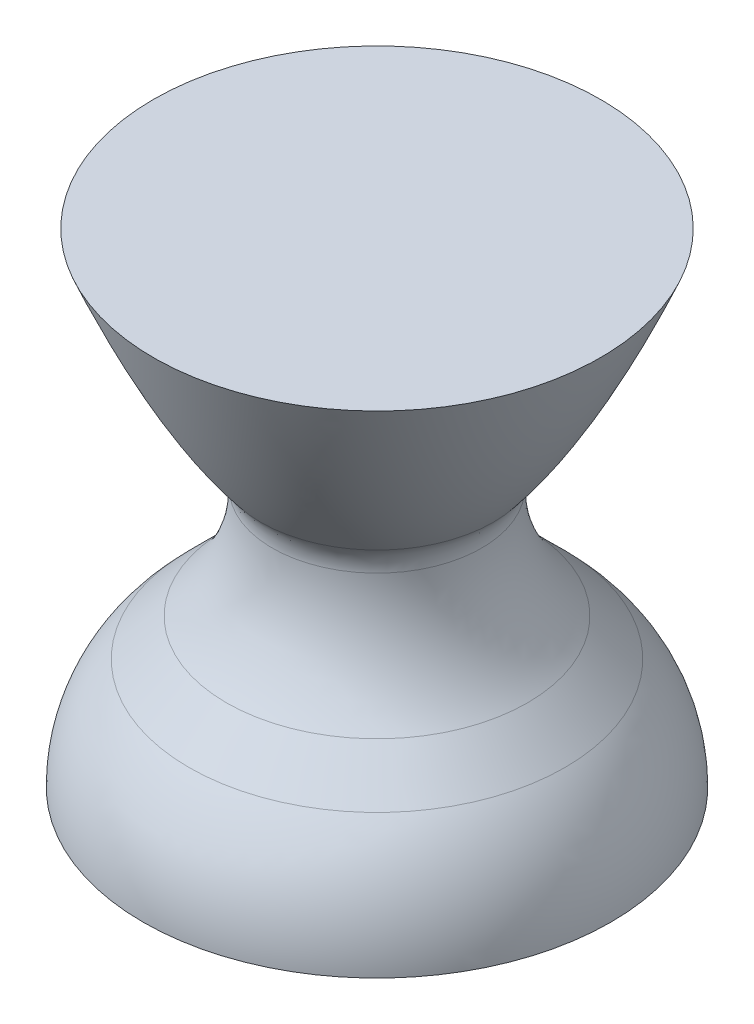
from build123d import *


with BuildPart() as part:
    # Sketch1 → Revolve1 (revolve)
    with BuildSketch(Plane.XY, mode=Mode.PRIVATE) as revolve1_sk:
        with BuildLine():
            Line((53.881648239, -59.727398382), (0, -59.727398382))
            Line((0, -59.727398382), (0, 51.720538141))
            Line((0, 51.720538141), (51.50993, 51.720538141))
            add(Edge.make_bspline(
                [(26.7953998, 6.509515166), (39.1526649, 21.980332275), (51.50993, 51.720538141)],
                knots=[0, 0, 0, 1, 1, 1], degree=2))
            add(Edge.make_bspline(
                [(24.099188471, 0.000275515), (24.099189098, 0.036168168), (24.099726929, 0.110389205), (24.10214432, 0.267916585), (24.108582165, 0.427339632), (24.120654196, 0.647039782), (24.141555684, 0.901708843), (24.175305316, 1.202812788), (24.226619903, 1.542326013), (24.290664299, 1.881272292), (24.367262199, 2.216629935), (24.456444169, 2.549514936), (24.55786201, 2.87836816), (24.671739668, 3.203622556), (24.797317368, 3.523902673), (24.935406574, 3.839942248), (25.084190898, 4.1495577), (25.24613282, 4.455058638), (25.416609102, 4.751577091), (25.602635318, 5.045979377), (25.791908867, 5.325794451), (26.004526072, 5.611003058), (26.178996971, 5.833189163), (26.366466353, 6.050227152), (26.504675845, 6.208917162), (26.670562667, 6.382397294), (26.744640858, 6.458754357), (26.7953998, 6.509515166)],
                knots=[0.082568816, 0.082568816, 0.082568816, 0.082568816, 0.082568816, 0.102426634, 0.122284453, 0.142142271, 0.162000089, 0.201715725, 0.241431362, 0.281146998, 0.320862634, 0.360578271, 0.400293907, 0.440009544, 0.47972518, 0.519440816, 0.559156453, 0.598872089, 0.638587725, 0.678303362, 0.718018998, 0.757734635, 0.797450271, 0.837165907, 0.857023726, 0.876881544, 0.91659718, 0.91659718, 0.91659718, 0.91659718, 0.91659718], degree=4))
            add(Edge.make_bspline(
                [(24.099188471, 0.000275515), (24.099189702, -0.070253128), (24.09971885, -0.213308671), (24.102094536, -0.542907397), (24.108418931, -0.823884877), (24.117904054, -1.194546552), (24.130546348, -1.513159539), (24.146346573, -1.861664084), (24.165301833, -2.193431352), (24.192939448, -2.61779388), (24.232407657, -3.121758427), (24.30342032, -3.879703155), (24.423247294, -4.886174868), (24.599606665, -6.05643524), (24.851005859, -7.384890894), (25.151915945, -8.703298994), (25.50189126, -10.009361687), (25.900481625, -11.301544074), (26.347066039, -12.577823812), (26.841123975, -13.83661196), (27.381793779, -15.075921604), (27.968600048, -16.294334268), (28.600260064, -17.489663267), (29.276653067, -18.661012229), (29.995565778, -19.805467867), (30.75814268, -20.923584544), (31.459287877, -21.874136229), (32.08885681, -22.673169948), (32.624249106, -23.320146605), (33.07237646, -23.839729482), (33.50857072, -24.329540711), (33.935946817, -24.788208854), (34.245679337, -25.113592774), (34.536980656, -25.40937351), (34.636533124, -25.509674395), (34.686403502, -25.55954658)],
                knots=[0.082637729, 0.082637729, 0.082637729, 0.082637729, 0.082637729, 0.092574926, 0.102512123, 0.11244932, 0.122386517, 0.132323714, 0.142260911, 0.152198108, 0.162135305, 0.182009699, 0.201884093, 0.24163288, 0.281381668, 0.321130456, 0.360879243, 0.400628031, 0.440376819, 0.480125606, 0.519874394, 0.559623181, 0.599371969, 0.639120757, 0.678869544, 0.718618332, 0.75836712, 0.798115907, 0.817990301, 0.837864695, 0.857739089, 0.877613483, 0.897487877, 0.907425074, 0.91736227, 0.91736227, 0.91736227, 0.91736227, 0.91736227], degree=4))
            Line((34.686403502, -25.55954658), (43.294031702, -34.167174779))
            add(Edge.make_bspline(
                [(53.881648239, -59.727398382), (53.881647008, -59.656868328), (53.881117865, -59.515291274), (53.878742017, -59.181449787), (53.872417419, -58.904680664), (53.862931934, -58.532452659), (53.850289038, -58.212722793), (53.830538212, -57.781479613), (53.800525874, -57.28084507), (53.756313714, -56.687883336), (53.677409048, -55.848365536), (53.577547462, -55.00805103), (53.456796391, -54.172320599), (53.286931432, -53.172310408), (53.092184802, -52.177327988), (52.86649574, -51.188424249), (52.610134849, -50.207374203), (52.32940997, -49.232962903), (52.024469374, -48.265854385), (51.633658471, -47.149020227), (51.139641007, -45.890293563), (50.598854405, -44.650853958), (50.012181586, -43.432586677), (49.380240895, -42.236978387), (48.704245899, -41.066040024), (47.984596196, -39.920857799), (47.22322282, -38.803961377), (46.519989747, -37.851336919), (45.893658628, -37.055557253), (45.352938374, -36.40326641), (44.915247645, -35.894132759), (44.514896888, -35.446877781), (44.181578203, -35.084516308), (43.874045326, -34.760225272), (43.67419311, -34.551434571), (43.444512777, -34.318401406), (43.343903856, -34.217047173), (43.294031702, -34.167174779)],
                knots=[0.082637729, 0.082637729, 0.082637729, 0.082637729, 0.082637729, 0.092574926, 0.102512123, 0.11244932, 0.122386517, 0.132323714, 0.142260911, 0.162135305, 0.182009699, 0.201884093, 0.24163288, 0.261507274, 0.281381668, 0.321130456, 0.360879243, 0.380753637, 0.400628031, 0.440376819, 0.480125606, 0.519874394, 0.559623181, 0.599371969, 0.639120757, 0.678869544, 0.718618332, 0.75836712, 0.798115907, 0.817990301, 0.837864695, 0.857739089, 0.877613483, 0.88755068, 0.897487877, 0.907425074, 0.91736227, 0.91736227, 0.91736227, 0.91736227, 0.91736227], degree=4))
        make_face()
    revolve(revolve1_sk.sketch.rotate(Axis((0, 61.162466261, 0), (0, -1, 0)), 180), axis=Axis((0, 61.162466261, 0), (0, -1, 0)))


solid = part.part
